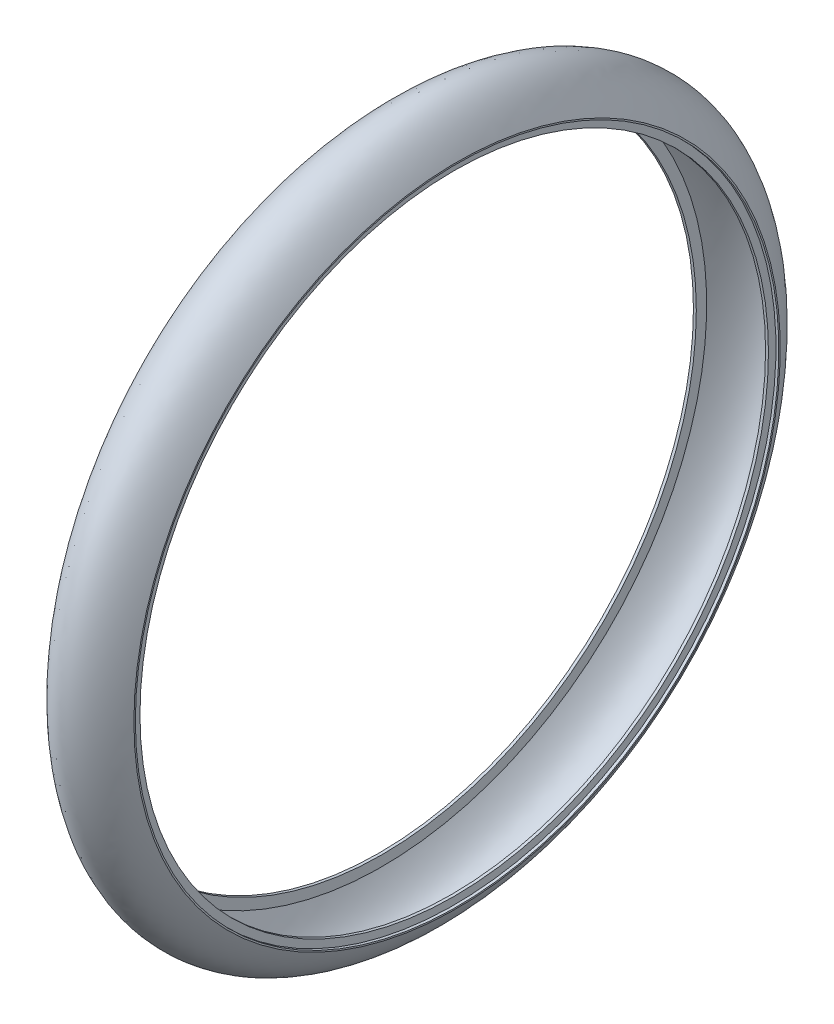
from build123d import *


with BuildPart() as part:
    # Sketch2 → Revolve2 (revolve)
    with BuildSketch(Plane.XY, mode=Mode.PRIVATE) as revolve2_sk:
        with BuildLine():
            Line((28, 223), (28, 224))
            add(Edge.make_bspline(
                [(-28, 224), (0.637105464, 273.282336613), (28, 224)],
                knots=[0, 0, 0, 1, 1, 1], degree=2))
            Line((-28, 224), (-28, 223))
            Line((-28, 223), (-26, 223))
            Line((-26, 223), (-26, 217.8))
            Line((-26, 217.8), (-24, 217.8))
            Line((-24, 217.8), (-24, 225))
            Line((-24, 225), (-25.081218575, 225))
            add(Edge.make_bspline(
                [(-25.081218575, 225), (-24.803751608, 225.45777092), (-24.237614436, 226.377618943), (-23.119772806, 228.136935628), (-21.72253005, 230.230207133), (-20.055318011, 232.558380785), (-17.843342422, 235.422340199), (-15.103291285, 238.549071728), (-11.866641202, 241.577463879), (-8.697647985, 243.88853238), (-4.578991313, 246.034494913), (0.334957233, 247.047411067), (5.210258098, 246.029099892), (9.261140781, 243.884708593), (12.362605587, 241.575555693), (15.515071363, 238.548885253), (18.1707605, 235.422942751), (20.306490742, 232.559178115), (21.912117195, 230.230947024), (23.254272667, 228.137440008), (24.32591937, 226.37789186), (24.867994621, 225.457809999), (25.133447636, 225)],
                knots=[0.021109035, 0.021109035, 0.021109035, 0.021109035, 0.036079914, 0.051050794, 0.080992554, 0.110934313, 0.140876073, 0.200759592, 0.260643111, 0.32052663, 0.380410149, 0.500177187, 0.619944225, 0.679827744, 0.739711263, 0.799594782, 0.859478301, 0.889420061, 0.91936182, 0.94930358, 0.96427446, 0.979245339, 0.979245339, 0.979245339, 0.979245339], degree=3))
            Line((25.133447636, 225), (24, 225))
            Line((24, 225), (24, 217.8))
            Line((24, 217.8), (26, 217.8))
            Line((26, 217.8), (26, 223))
            Line((26, 223), (28, 223))
        make_face()
    revolve(revolve2_sk.sketch.rotate(Axis((-92.729883755, 0, 0), (1, 0, 0)), 90), axis=Axis((-92.729883755, 0, 0), (1, 0, 0)))


solid = part.part
